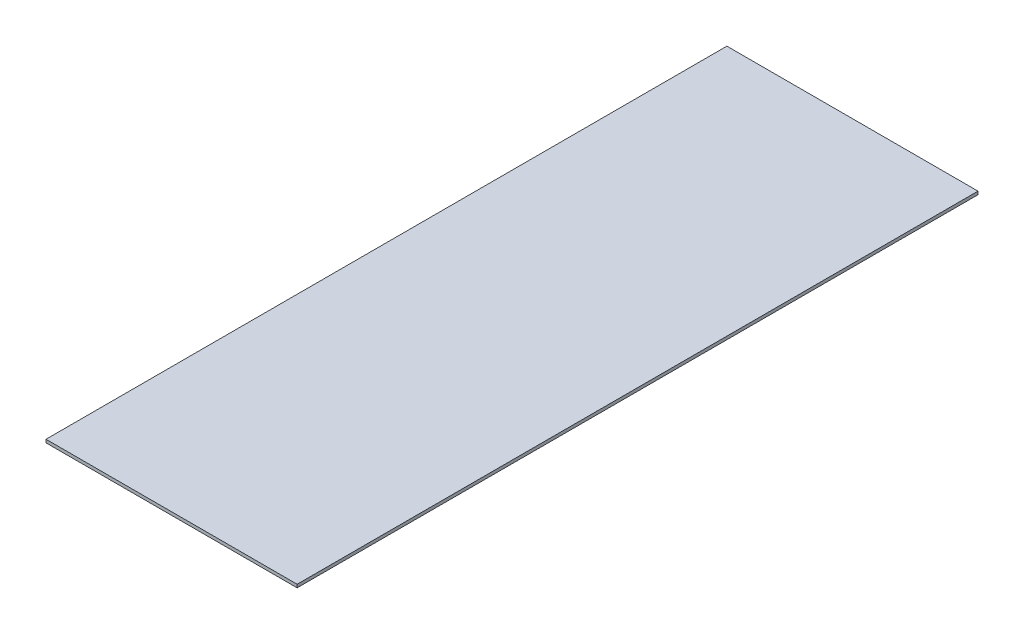
from build123d import *

# Parameters (mm, degrees)
SKETCH1_W           = 203.2
SKETCH1_H           = 550.926
BOSS_EXTRUDE1_DEPTH = 2.54


with BuildPart() as part:
    # Sketch1 → Boss-Extrude1 (new body)
    with BuildSketch(Plane(origin=(0, 0, 0), x_dir=(1, 0, 0), z_dir=(0, 1, 0))):
        with Locations((71.30004327, -239.153134497)):
            Rectangle(SKETCH1_W, SKETCH1_H)
    extrude(amount=BOSS_EXTRUDE1_DEPTH)


solid = part.part
